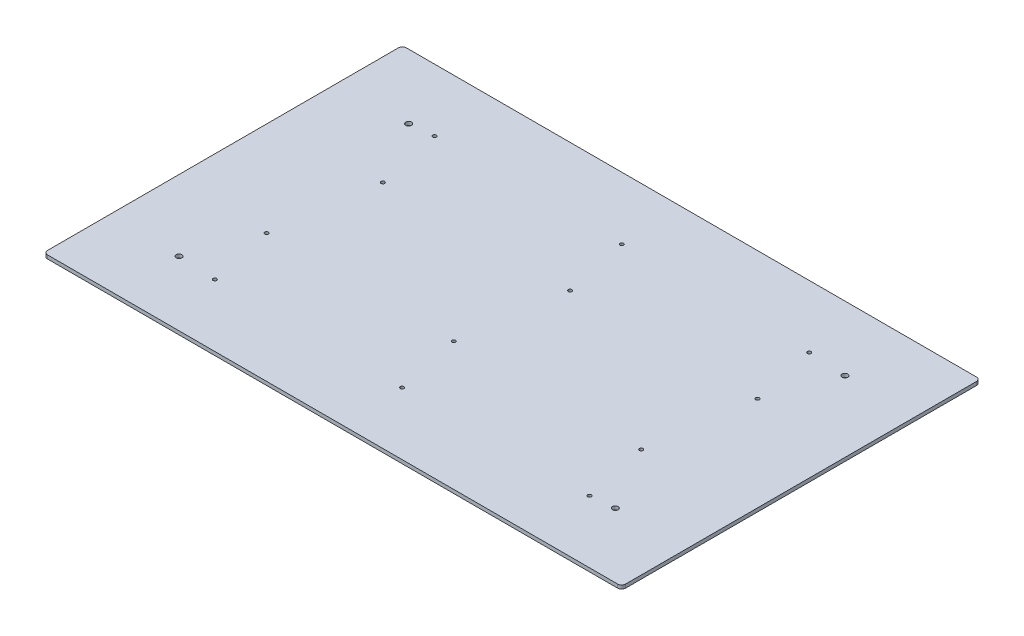
from build123d import *

# Parameters (mm, degrees)
SKETCH1_W                 = 368.3
SKETCH1_H                 = 228.6
BOSS_EXTRUDE1_DEPTH       = 2.286
F_6_CLEARANCE_HOLE1_D     = 3.6576
TAP_DRILL_FOR_4_40_TAP1_D = 2.2606
FILLET1_R                 = 2.54


with BuildPart() as part:
    # Sketch1 → Boss-Extrude1 (new body)
    with BuildSketch(Plane(origin=(0, 0, 0), x_dir=(1, 0, 0), z_dir=(0, 1, 0))):
        Rectangle(SKETCH1_W, SKETCH1_H)
    extrude(amount=BOSS_EXTRUDE1_DEPTH)

    # #6 Clearance Hole1 (through all)
    with Locations(Plane(origin=(0, 0, 0), x_dir=(-1, 0, 0), z_dir=(0, -1, 0))):
        with Locations((-139.0015, 73.152), (139.0015, 73.152), (139.0015, -73.152), (-139.0015, -73.152)):
            Hole(F_6_CLEARANCE_HOLE1_D / 2)

    # Tap Drill for #4-40 Tap1 (through all)
    with Locations(Plane(origin=(0, 0, 0), x_dir=(-1, 0, 0), z_dir=(0, -1, 0))):
        with Locations((-114.847391596, 74.54728998), (-123.912608404, 32.51371002), (4.532608404, 74.54728998), (-4.532608404, 32.51371002), (123.912608404, 74.54728998), (114.847391596, 32.51371002), (123.912608404, -32.51371002), (114.847391596, -74.54728998), (4.532608404, -32.51371002), (-4.532608404, -74.54728998), (-114.847391596, -32.51371002), (-123.912608404, -74.54728998)):
            Hole(TAP_DRILL_FOR_4_40_TAP1_D / 2)

    # Fillet1
    fillet1_edges = [part.edges().sort_by_distance(p)[0] for p in [
        (184.15, 1.143, 114.3),
        (-184.15, 1.143, 114.3),
        (-184.15, 1.143, -114.3),
        (184.15, 1.143, -114.3),
    ]]
    fillet(fillet1_edges, radius=FILLET1_R)


solid = part.part
